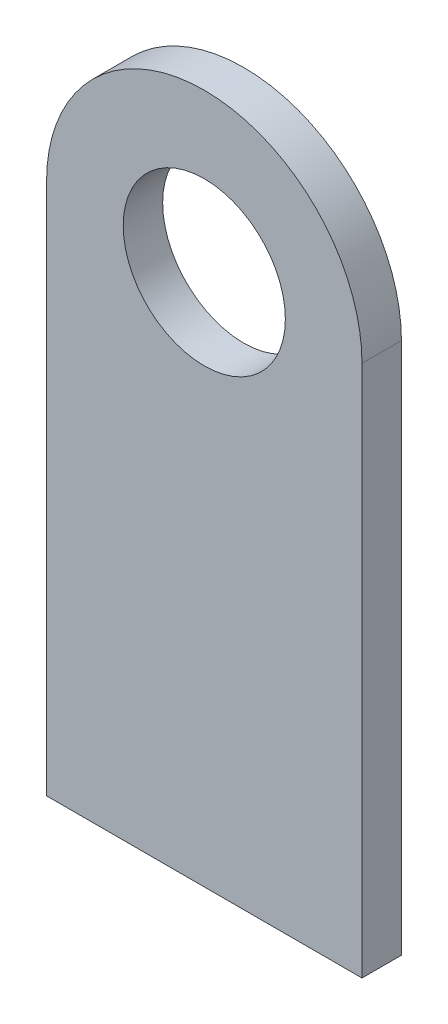
from build123d import *

# Parameters (mm, degrees)
SKETCH1_R           = 3.2639
BOSS_EXTRUDE1_DEPTH = 1.5875


with BuildPart() as part:
    # Sketch1 → Boss-Extrude1 (new body)
    with BuildSketch(Plane.XY):
        with BuildLine():
            Line((-6.35, -21.43125), (6.35, -21.43125))
            Line((6.35, -21.43125), (6.35, 0))
            ThreePointArc((6.35, 0), (0, 6.35), (-6.35, 0))
            Line((-6.35, 0), (-6.35, -21.43125))
        make_face()
        Circle(SKETCH1_R, mode=Mode.SUBTRACT)
    extrude(amount=BOSS_EXTRUDE1_DEPTH)


solid = part.part
